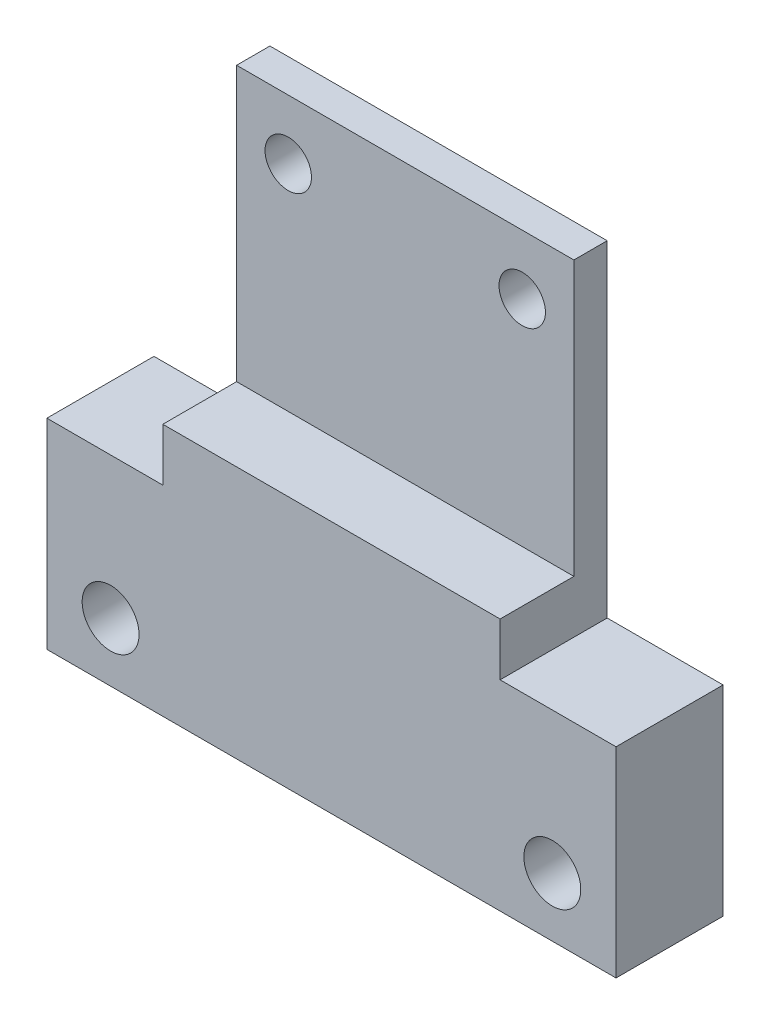
from build123d import *

# Parameters (mm, degrees)
BOSS_EXTRUDE1_DEPTH = 5.08
SKETCH2_W           = 16
SKETCH2_H           = 13
CUT_EXTRUDE1_DEPTH  = 3.5
SKETCH3_R           = 2
CUT_EXTRUDE2_DEPTH  = 3
SKETCH4_R           = 1.1
CUT_EXTRUDE3_DEPTH  = 21
SKETCH5_R           = 1.35
CUT_EXTRUDE4_DEPTH  = 21


with BuildPart() as part:
    # Sketch1 → Boss-Extrude1 (new body)
    with BuildSketch(Plane.XY):
        Polygon((0, 9.5), (5.5, 9.5), (5.5, 25), (21.5, 25), (21.5, 9.5), (27, 9.5), (27, 0), (0, 0), align=None)
    extrude(amount=BOSS_EXTRUDE1_DEPTH)

    # Sketch2 → Cut-Extrude1 (cut)
    with BuildSketch(Plane.XY.offset(5.08)):
        with Locations((13.5, 18.5)):
            Rectangle(SKETCH2_W, SKETCH2_H)
    extrude(amount=-CUT_EXTRUDE1_DEPTH, mode=Mode.SUBTRACT)

    # Sketch3 → Cut-Extrude2 (cut)
    with BuildSketch(Plane(origin=(0, 0, 0), x_dir=(-1, 0, 0), z_dir=(0, 0, -1))):
        with Locations((-23.9775, 2.794)):
            Circle(SKETCH3_R)
        with Locations((-3.0225, 2.794)):
            Circle(SKETCH3_R)
    extrude(amount=-CUT_EXTRUDE2_DEPTH, mode=Mode.SUBTRACT)

    # Sketch4 → Cut-Extrude3 (cut)
    with BuildSketch(Plane(origin=(0, 0, 0), x_dir=(-1, 0, 0), z_dir=(0, 0, -1))):
        with Locations((-19.0499, 22.1742)):
            Circle(SKETCH4_R)
        with Locations((-7.9501, 22.1742)):
            Circle(SKETCH4_R)
    extrude(amount=-CUT_EXTRUDE3_DEPTH, mode=Mode.SUBTRACT)

    # Sketch5 → Cut-Extrude4 (cut)
    with BuildSketch(Plane(origin=(0, 0, 3), x_dir=(-1, 0, 0), z_dir=(0, 0, -1))):
        with Locations((-23.9775, 2.794)):
            Circle(SKETCH5_R)
        with Locations((-3.0225, 2.794)):
            Circle(SKETCH5_R)
    extrude(amount=-CUT_EXTRUDE4_DEPTH, mode=Mode.SUBTRACT)


solid = part.part
